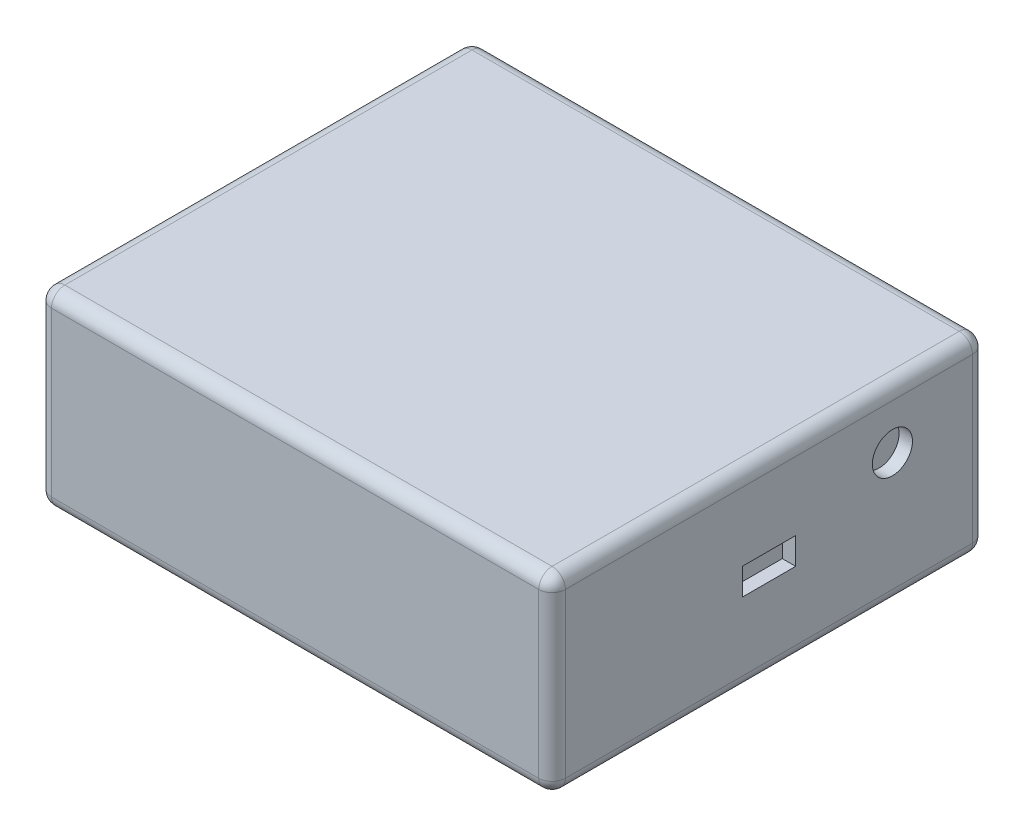
from build123d import *

# Parameters (mm, degrees)
ESQUISSE1_W             = 77
ESQUISSE1_H             = 65
BOSS_EXTRU_1_DEPTH      = 28.5
CONG_2_R                = 2
ESQUISSE2_R             = 3
ESQUISSE2_W             = 8
ESQUISSE2_H             = 4
ENL_V_MAT_EXTRU_1_DEPTH = 2


with BuildPart() as part:
    # Esquisse1 → Boss.-Extru.1 (new body)
    with BuildSketch(Plane(origin=(0, 0, 0), x_dir=(1, 0, 0), z_dir=(0, 1, 0))):
        Rectangle(ESQUISSE1_W, ESQUISSE1_H)
    extrude(amount=BOSS_EXTRU_1_DEPTH)

    # Congé2
    cong_2_edges = [part.edges().sort_by_distance(p)[0] for p in [
        (-38.5, 28.5, 0),
        (0, 28.5, 32.5),
        (38.5, 28.5, 0),
        (0, 0, 32.5),
        (-38.5, 0, 0),
        (0, 0, -32.5),
        (38.5, 0, 0),
        (38.5, 14.25, 32.5),
        (-38.5, 14.25, 32.5),
        (-38.5, 14.25, -32.5),
        (38.5, 14.25, -32.5),
        (0, 28.5, -32.5),
    ]]
    fillet(cong_2_edges, radius=CONG_2_R)

    # Esquisse2 → Enlèv. mat.-Extru.1 (cut)
    with BuildSketch(Plane(origin=(38.5, 0, 0), x_dir=(0, 0, -1), z_dir=(1, 0, 0))):
        with Locations((18.5, 19.75)):
            Circle(ESQUISSE2_R)
        with Locations((0, 14.25)):
            Rectangle(ESQUISSE2_W, ESQUISSE2_H)
    extrude(amount=-ENL_V_MAT_EXTRU_1_DEPTH, mode=Mode.SUBTRACT)


solid = part.part
